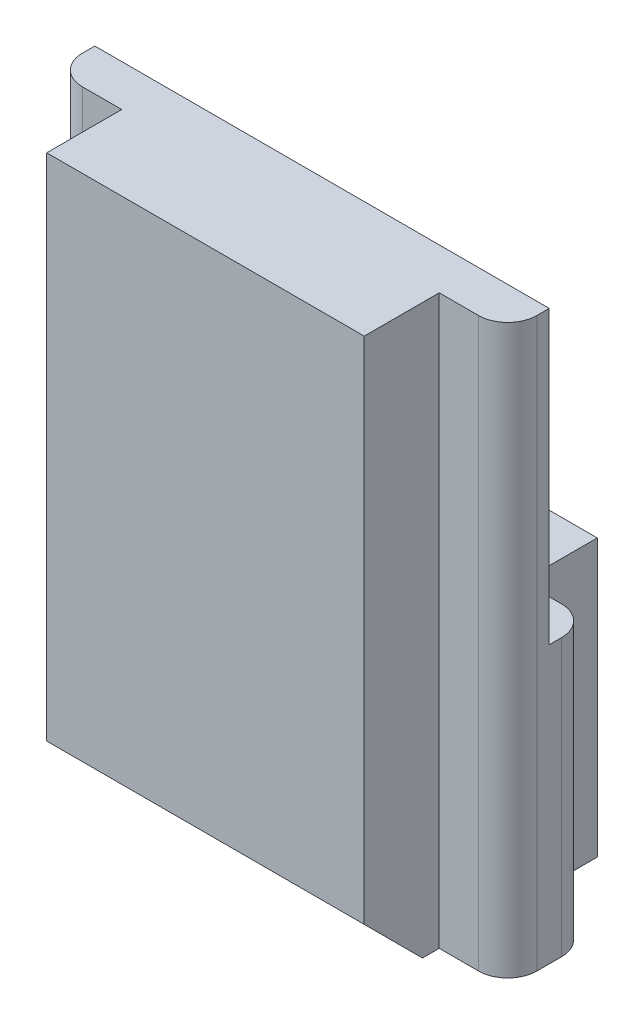
from build123d import *

# Parameters (mm, degrees)
ESQUISSE1_W             = 10.9
ESQUISSE1_H             = 8
ESQUISSE1_W_2           = 2.35
ESQUISSE1_H_2           = 2.85
BOSS_EXTRU_1_DEPTH      = 19.49
CHANFREIN1_SIZE         = 2
ESQUISSE2_W             = 15.6
ESQUISSE2_H             = 4
ENL_V_MAT_EXTRU_1_DEPTH = 10
CONG_1_R                = 1


with BuildPart() as part:
    # Esquisse1 → Boss.-Extru.1 (new body)
    with BuildSketch(Plane(origin=(0, 0, 0), x_dir=(1, 0, 0), z_dir=(0, 1, 0))):
        with Locations((5.45, 4)):
            Rectangle(ESQUISSE1_W, ESQUISSE1_H)
        with Locations((-1.175, 4)):
            Rectangle(ESQUISSE1_W_2, ESQUISSE1_H_2)
        with Locations((12.075, 4)):
            Rectangle(ESQUISSE1_W_2, ESQUISSE1_H_2)
    extrude(amount=BOSS_EXTRU_1_DEPTH)

    # Chanfrein1
    chanfrein1_edges = [part.edges().sort_by_distance(p)[0] for p in [
        (5.45, 0, 0),
    ]]
    chamfer(chanfrein1_edges, length=CHANFREIN1_SIZE)

    # Esquisse2 → Enlèv. mat.-Extru.1 (cut)
    with BuildSketch(Plane(origin=(0, 19.49, 0), x_dir=(1, 0, 0), z_dir=(0, 1, 0))):
        with Locations((5.45, 6)):
            Rectangle(ESQUISSE2_W, ESQUISSE2_H)
    extrude(amount=-ENL_V_MAT_EXTRU_1_DEPTH, mode=Mode.SUBTRACT)

    # Congé1
    cong_1_edges = [part.edges().sort_by_distance(p)[0] for p in [
        (-2.35, 9.745, -2.575),
        (13.25, 9.745, -2.575),
        (-2.35, 4.745, -5.425),
        (13.25, 4.745, -5.425),
    ]]
    fillet(cong_1_edges, radius=CONG_1_R)


solid = part.part
